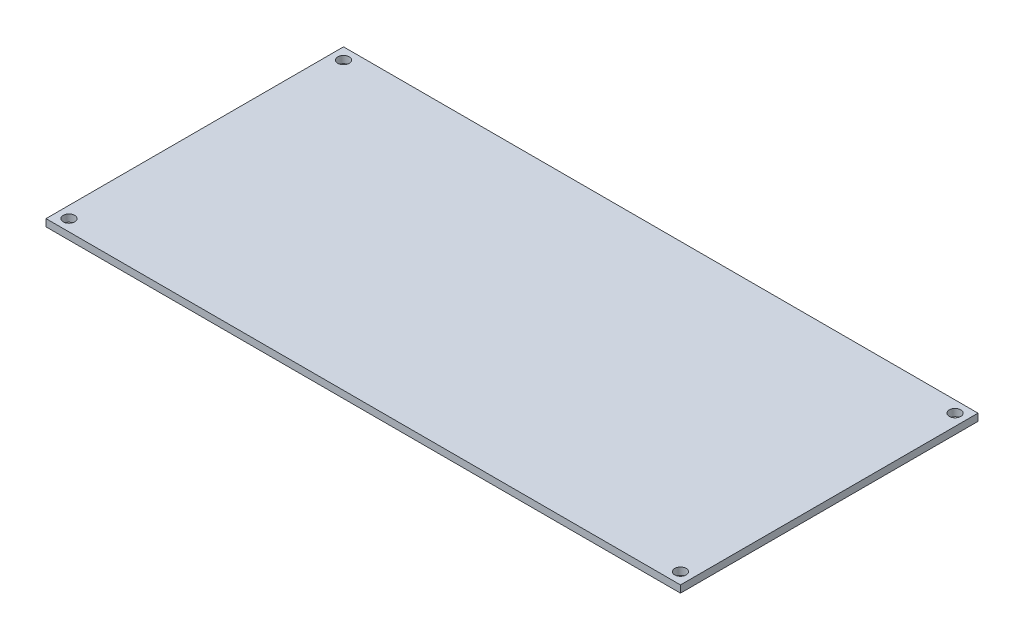
from build123d import *

# Parameters (mm, degrees)
ESQUISSE1_W             = 177
ESQUISSE1_H             = 83
BOSS_EXTRU_1_DEPTH      = 2
ENL_V_MAT_EXTRU_1_REACH = 197.504
ESQUISSE2_R             = 1.6


with BuildPart() as part:
    # Esquisse1 → Boss.-Extru.1 (new body)
    with BuildSketch(Plane(origin=(0, 0, 0), x_dir=(1, 0, 0), z_dir=(0, 1, 0))):
        with Locations((88.5, -41.5)):
            Rectangle(ESQUISSE1_W, ESQUISSE1_H)
    extrude(amount=BOSS_EXTRU_1_DEPTH)

    # Esquisse2 → Enlèv. mat.-Extru.1 (cut, up to next)
    with BuildSketch(Plane(origin=(0, 2, 0), x_dir=(1, 0, 0), z_dir=(0, 1, 0)), mode=Mode.PRIVATE) as enl_v_mat_extru_1_sk1:
        with Locations(Location((3.2, -3.2, 0), (0, 0, 270))):
            Circle(ESQUISSE2_R)
    enl_v_mat_extru_1_tool1 = extrude(enl_v_mat_extru_1_sk1.sketch, amount=-ENL_V_MAT_EXTRU_1_REACH, mode=Mode.PRIVATE) & part.part
    # Esquisse2 → Enlèv. mat.-Extru.1 (cut, up to next)
    with BuildSketch(Plane(origin=(0, 2, 0), x_dir=(1, 0, 0), z_dir=(0, 1, 0)), mode=Mode.PRIVATE) as enl_v_mat_extru_1_sk2:
        with Locations(Location((3.2, -79.8, 0), (0, 0, 270))):
            Circle(ESQUISSE2_R)
    enl_v_mat_extru_1_tool2 = extrude(enl_v_mat_extru_1_sk2.sketch, amount=-ENL_V_MAT_EXTRU_1_REACH, mode=Mode.PRIVATE) & part.part
    # Esquisse2 → Enlèv. mat.-Extru.1 (cut, up to next)
    with BuildSketch(Plane(origin=(0, 2, 0), x_dir=(1, 0, 0), z_dir=(0, 1, 0)), mode=Mode.PRIVATE) as enl_v_mat_extru_1_sk3:
        with Locations(Location((173.8, -3.2, 0), (0, 0, 270))):
            Circle(ESQUISSE2_R)
    enl_v_mat_extru_1_tool3 = extrude(enl_v_mat_extru_1_sk3.sketch, amount=-ENL_V_MAT_EXTRU_1_REACH, mode=Mode.PRIVATE) & part.part
    # Esquisse2 → Enlèv. mat.-Extru.1 (cut, up to next)
    with BuildSketch(Plane(origin=(0, 2, 0), x_dir=(1, 0, 0), z_dir=(0, 1, 0)), mode=Mode.PRIVATE) as enl_v_mat_extru_1_sk4:
        with Locations(Location((173.8, -79.8, 0), (0, 0, 270))):
            Circle(ESQUISSE2_R)
    enl_v_mat_extru_1_tool4 = extrude(enl_v_mat_extru_1_sk4.sketch, amount=-ENL_V_MAT_EXTRU_1_REACH, mode=Mode.PRIVATE) & part.part
    add(enl_v_mat_extru_1_tool1.solids().sort_by_distance((3.2, 2, 3.2))[0], mode=Mode.SUBTRACT)
    add(enl_v_mat_extru_1_tool2.solids().sort_by_distance((3.2, 2, 79.8))[0], mode=Mode.SUBTRACT)
    add(enl_v_mat_extru_1_tool3.solids().sort_by_distance((173.8, 2, 3.2))[0], mode=Mode.SUBTRACT)
    add(enl_v_mat_extru_1_tool4.solids().sort_by_distance((173.8, 2, 79.8))[0], mode=Mode.SUBTRACT)


solid = part.part
